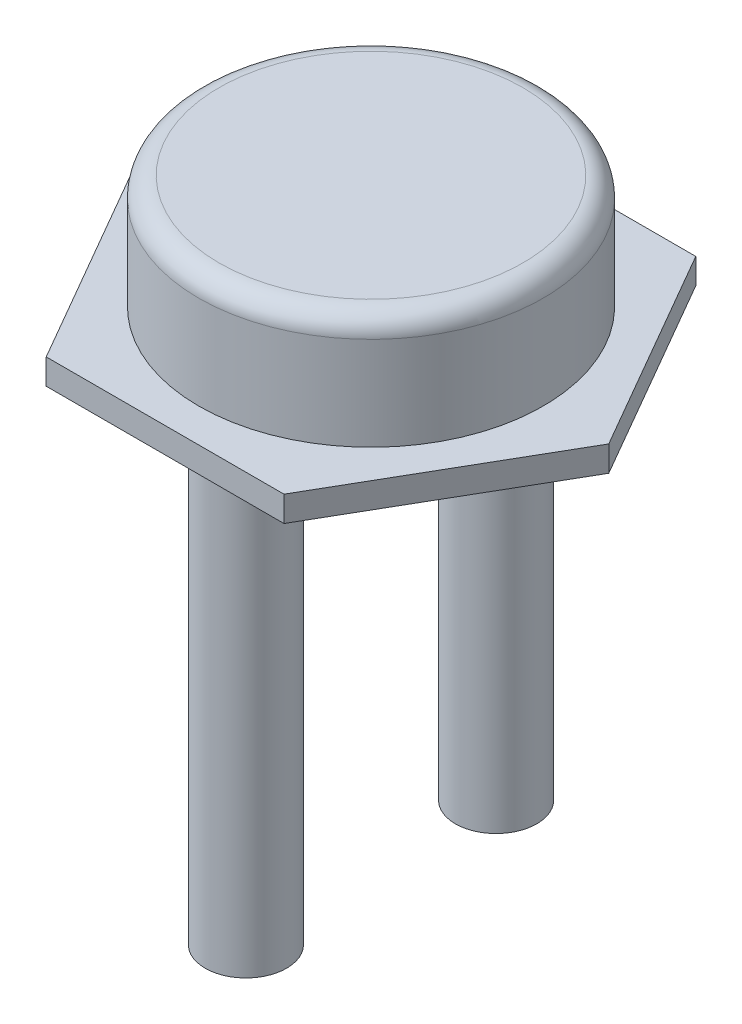
from build123d import *

# Parameters (mm, degrees)
SKETCH1_R           = 10.75
BOSS_EXTRUDE1_DEPTH = 7.1
BOSS_EXTRUDE2_DEPTH = 1.5875
SKETCH3_R           = 2.54
BOSS_EXTRUDE3_DEPTH = 29
FILLET1_R           = 1.27


with BuildPart() as part:
    # Sketch1 → Boss-Extrude1 (new body)
    with BuildSketch(Plane(origin=(0, 0, 0), x_dir=(1, 0, 0), z_dir=(0, 1, 0))):
        with Locations(Location((0, 0, 0), (0, 0, 270))):
            Circle(SKETCH1_R)
    extrude(amount=BOSS_EXTRUDE1_DEPTH)

    # Sketch2 → Boss-Extrude2 (add)
    with BuildSketch(Plane.XZ):
        Polygon((-14.837901918, 0), (-7.418950959, -12.85), (7.418950959, -12.85), (14.837901918, 0), (7.418950959, 12.85), (-7.418950959, 12.85), align=None)
    extrude(amount=BOSS_EXTRUDE2_DEPTH)

    # Sketch3 → Boss-Extrude3 (add)
    with BuildSketch(Plane.XZ.offset(1.5875)):
        with Locations(Location((0, 7.80660503, 0), (0, 0, 90))):
            Circle(SKETCH3_R)
        with Locations(Location((0, -7.80660503, 0), (0, 0, 90))):
            Circle(SKETCH3_R)
    extrude(amount=BOSS_EXTRUDE3_DEPTH)

    # Fillet1
    fillet1_edges = [part.edges().sort_by_distance(p)[0] for p in [
        (0, 7.1, -10.75),
    ]]
    fillet(fillet1_edges, radius=FILLET1_R)


solid = part.part
